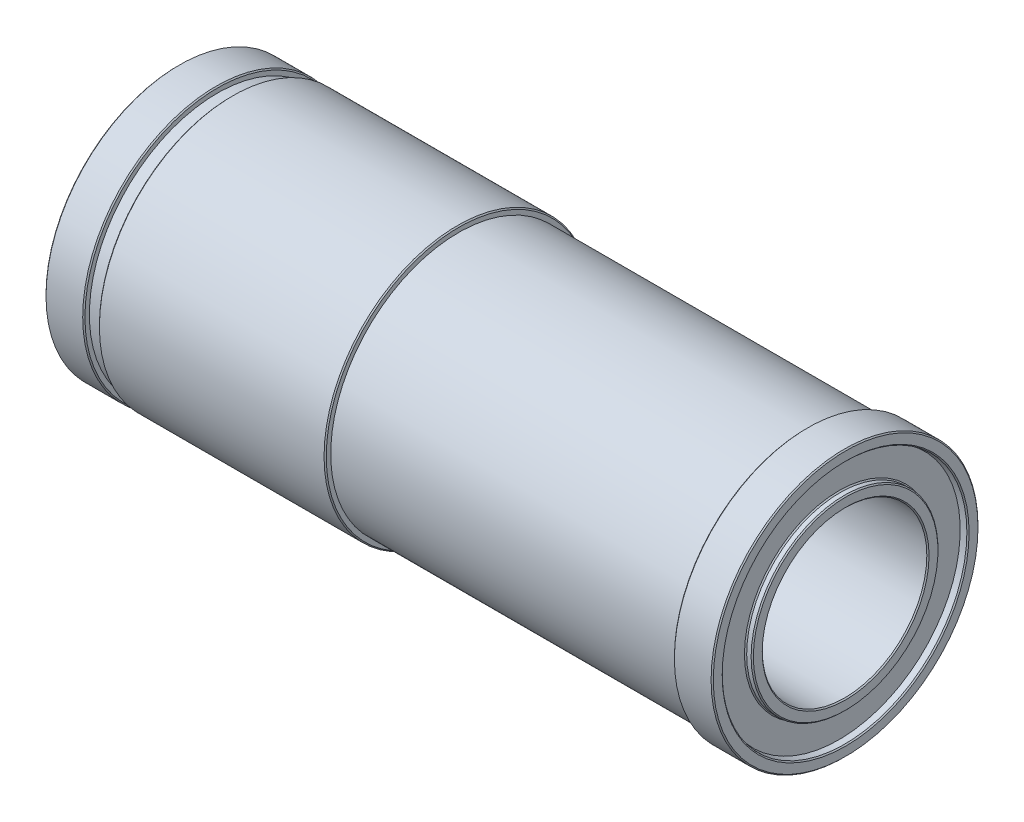
from build123d import *


with BuildPart() as part:
    # Эскиз3 → Повернуть2 (revolve)
    with BuildSketch(Plane.XY, mode=Mode.PRIVATE) as revolve_2_sk:
        Polygon((25.2, 8.9), (25.1, 9), (4.9, 9), (4.8, 8.9), (4.8, 8.5), (3.5, 8.5), (3.5, 8.9), (3.4, 9), (0.1, 9), (0, 8.9), (0, 8), (59.9, 8), (60, 8.1), (60, 8.9), (59.9, 9), (56.6, 9), (56.5, 8.9), (56.5, 8.5), (25.2, 8.5), align=None)
    revolve(revolve_2_sk.sketch.rotate(Axis((0, -3, 0), (1, 0, 0)), 270), axis=Axis((0, -3, 0), (1, 0, 0)))


with BuildPart() as body_2:
    # Эскиз7 → Повернуть3 (revolve)
    with BuildSketch(Plane.XY, mode=Mode.PRIVATE) as revolve_3_sk:
        Polygon((0, 4.5), (0, 5.3), (0.1, 5.4), (0.5, 5.4), (0.6, 5.5), (0.6, 7.9), (59.4, 7.9), (59.4, 5.5), (59.5, 5.4), (59.9, 5.4), (60, 5.3), (60, 4.5), (59.9, 4.4), (0.1, 4.4), align=None)
    revolve(revolve_3_sk.sketch.rotate(Axis((30, -3, 0), (-1, 0, 0)), 270), axis=Axis((30, -3, 0), (-1, 0, 0)))


solid = Compound([part.part, body_2.part])
